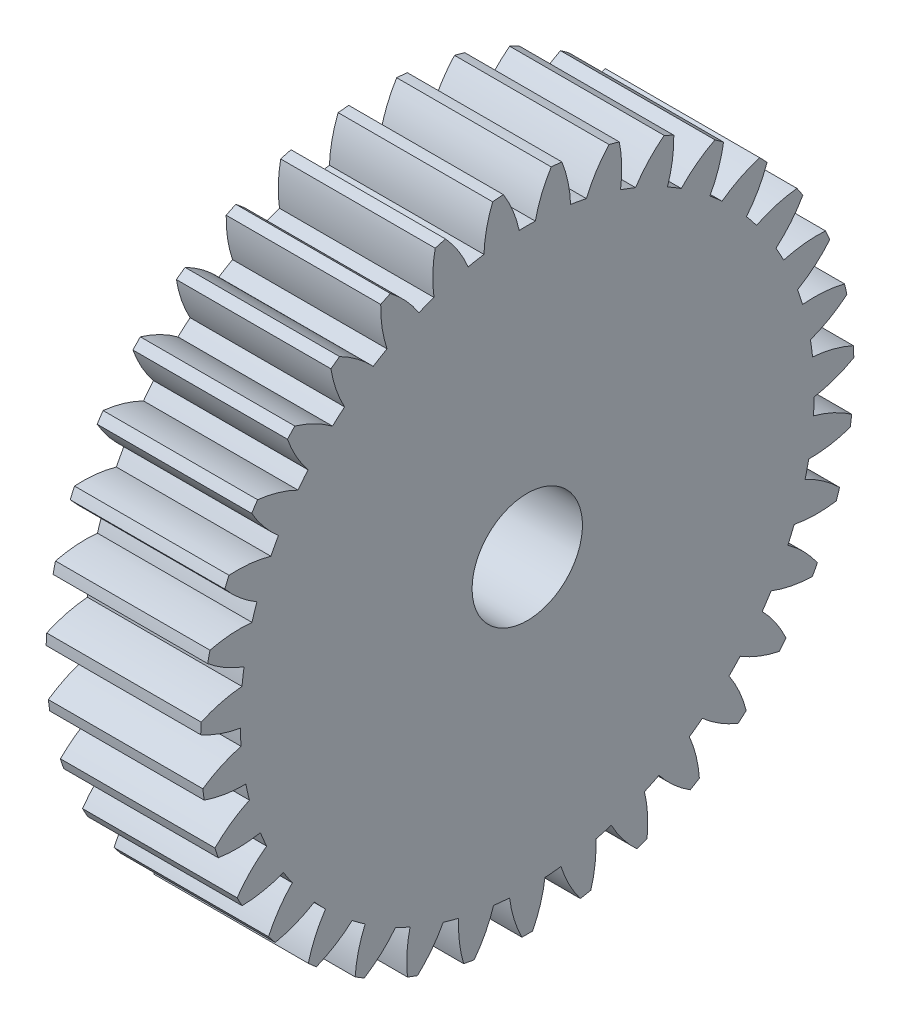
from build123d import *

# Parameters (mm, degrees)
BASPROSKE_W     = 7
BASPROSKE_H     = 14.8
TOOTHCUT_DEPTH  = 23.069888989
TEETHCUTS_COUNT = 35
TEETHCUTS_ANGLE = 349.714285714
BORSKE_R        = 2.5
BORE_DEPTH      = 50.0000508


with BuildPart() as part:
    # BasProSke → Base-Revolve (revolve)
    with BuildSketch(Plane(origin=(0, 0, 0), x_dir=(1, 0, 0), z_dir=(0, 1, 0)), mode=Mode.PRIVATE) as base_revolve_sk:
        with Locations((3.5, 7.4)):
            Rectangle(BASPROSKE_W, BASPROSKE_H)
    revolve(base_revolve_sk.sketch.rotate(Axis((-10, 0, 0), (1, 0, 0)), 180), axis=Axis((-10, 0, 0), (1, 0, 0)))

    # TooCutSke → ToothCut (cut, through all)
    with BuildSketch(Plane(origin=(0, 0, 0), x_dir=(0, 0, -1), z_dir=(1, 0, 0))):
        with BuildLine():
            ThreePointArc((0.364394922, 12.99389154), (0, 12.999), (-0.364394922, 12.99389154))
            ThreePointArc((-0.364394922, 12.99389154), (-0.654583341, 13.921248863), (-1.100709508, 14.784482532))
            ThreePointArc((-1.100709508, 14.784482532), (0, 14.8254), (1.100709508, 14.784482532))
            ThreePointArc((1.100709508, 14.784482532), (0.654583341, 13.921248863), (0.364394922, 12.99389154))
        make_face()
    toothcut = extrude(amount=TOOTHCUT_DEPTH, mode=Mode.SUBTRACT)

    # TeethCuts: ToothCut ×35 about axis
    teethcuts_axis = Axis((-10, 0, 0), (1, 0, 0))
    for i in range(1, TEETHCUTS_COUNT):
        add(toothcut.rotate(teethcuts_axis, i * TEETHCUTS_ANGLE / (TEETHCUTS_COUNT - 1)), mode=Mode.SUBTRACT)

    # BorSke → Bore (cut, symmetric)
    with BuildSketch(Plane(origin=(0, 0, 0), x_dir=(0, 0, -1), z_dir=(1, 0, 0))):
        with Locations(Location((0, 0, 0), (0, 0, 180))):
            Circle(BORSKE_R)
    extrude(amount=BORE_DEPTH, both=True, mode=Mode.SUBTRACT)


solid = part.part
